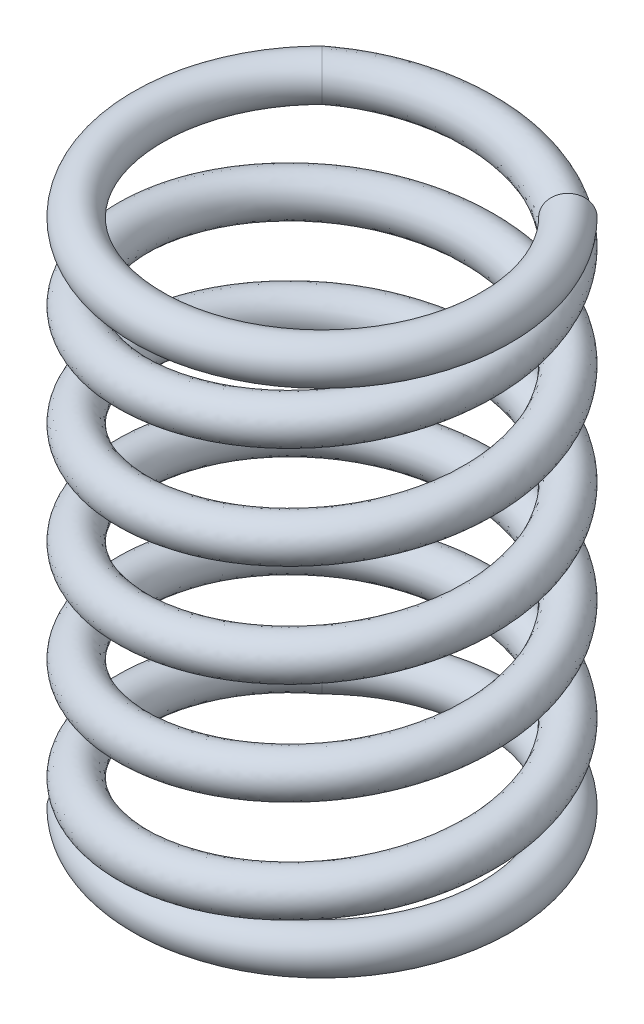
from build123d import *

# Parameters (mm, degrees)
BARRER1_PITCH       = 2
BARRER1_HEIGHT      = 10
BARRER1_RADIUS      = 3.405
BARRER1_START_ANGLE = -135
CROQUIS3_R          = 0.405
CROQUIS4_R          = 0.405
REVOLUCI_N1_ANGLE   = 270
CROQUIS6_R          = 0.405
REVOLUCI_N2_ANGLE   = 270


with BuildPart() as part:
    # Barrer1: sweep along a helix
    with BuildLine() as barrer1_path:
        add(Helix(BARRER1_PITCH, BARRER1_HEIGHT, BARRER1_RADIUS, center=(0, 0, 0), direction=(0, 1, 0), mode=Mode.PRIVATE).rotate(Axis((0, 0, 0), (0, 1, 0)), BARRER1_START_ANGLE))
    # Croquis3 → Barrer1 (sweep)
    with BuildSketch(Plane(origin=(0, 0, 0), x_dir=(0.7071067811866029, 0, 0.7071067811864922), z_dir=(-0.7071067811864922, 0, 0.7071067811866029))):
        with Locations((-3.405, 10)):
            Circle(CROQUIS3_R)
    sweep(path=barrer1_path.line, is_frenet=True)

    # Croquis4 → Revolución1 (revolve)
    with BuildSketch(Plane(origin=(0, 0, 0), x_dir=(0.7071067811866028, 1.9942708358578987e-15, 0.7071067811864923), z_dir=(-0.7071067811864923, 0, 0.7071067811866028))):
        with Locations((-3.405, 10)):
            Circle(CROQUIS4_R)
    revolve(axis=Axis((0, 0, 0), (0, 1, 0)), revolution_arc=REVOLUCI_N1_ANGLE)

    # Croquis6 → Revolución2 (revolve)
    with BuildSketch(Plane(origin=(0, 0, 0), x_dir=(-0.7071067811865562, 0, -0.7071067811865389), z_dir=(0.7071067811865389, 0, -0.7071067811865562))):
        with Locations((3.405, 0)):
            Circle(CROQUIS6_R)
    revolve(axis=Axis((0, 0, 0), (0, -1, 0)), revolution_arc=REVOLUCI_N2_ANGLE)


solid = part.part
